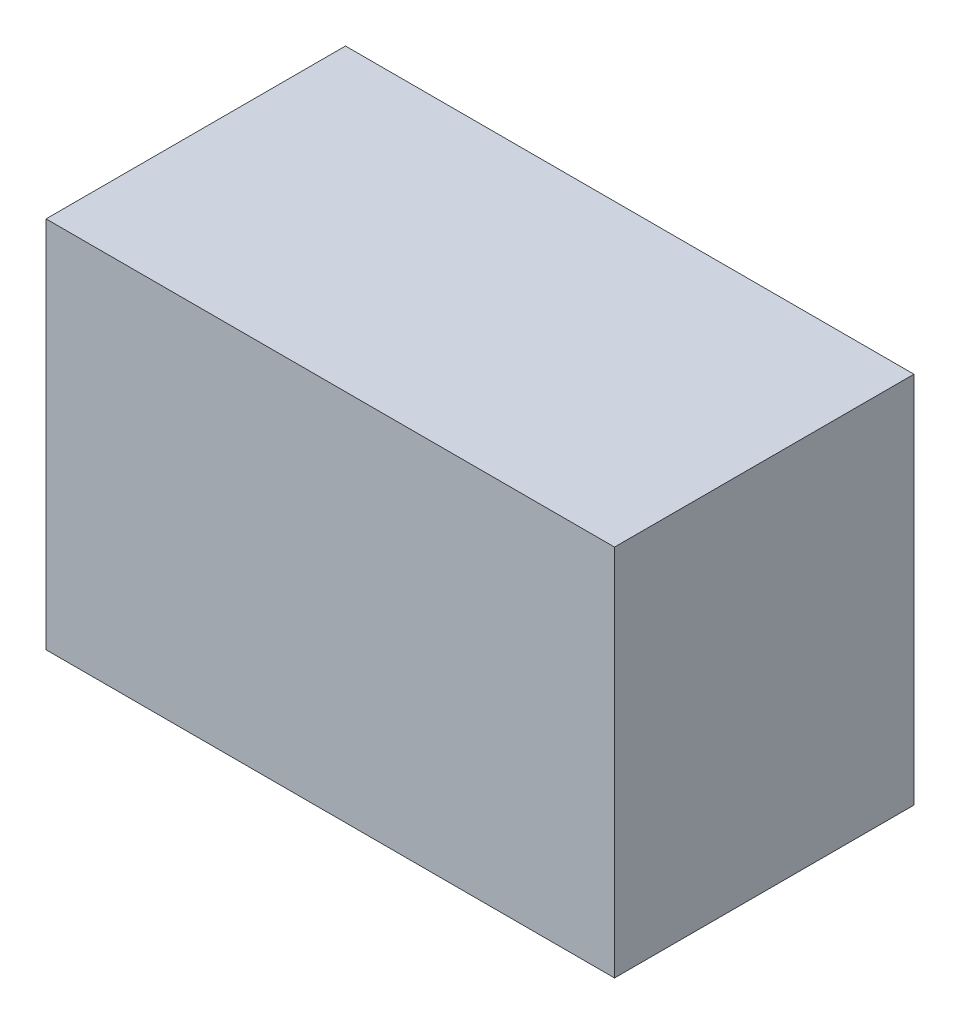
from build123d import *

# Parameters (mm, degrees)
SKETCH1_W           = 332.74
SKETCH1_H           = 175.26
BOSS_EXTRUDE1_DEPTH = 218.44


with BuildPart() as part:
    # Sketch1 → Boss-Extrude1 (new body)
    with BuildSketch(Plane(origin=(0, 0, 0), x_dir=(1, 0, 0), z_dir=(0, 1, 0))):
        Rectangle(SKETCH1_W, SKETCH1_H)
    extrude(amount=BOSS_EXTRUDE1_DEPTH)


solid = part.part
